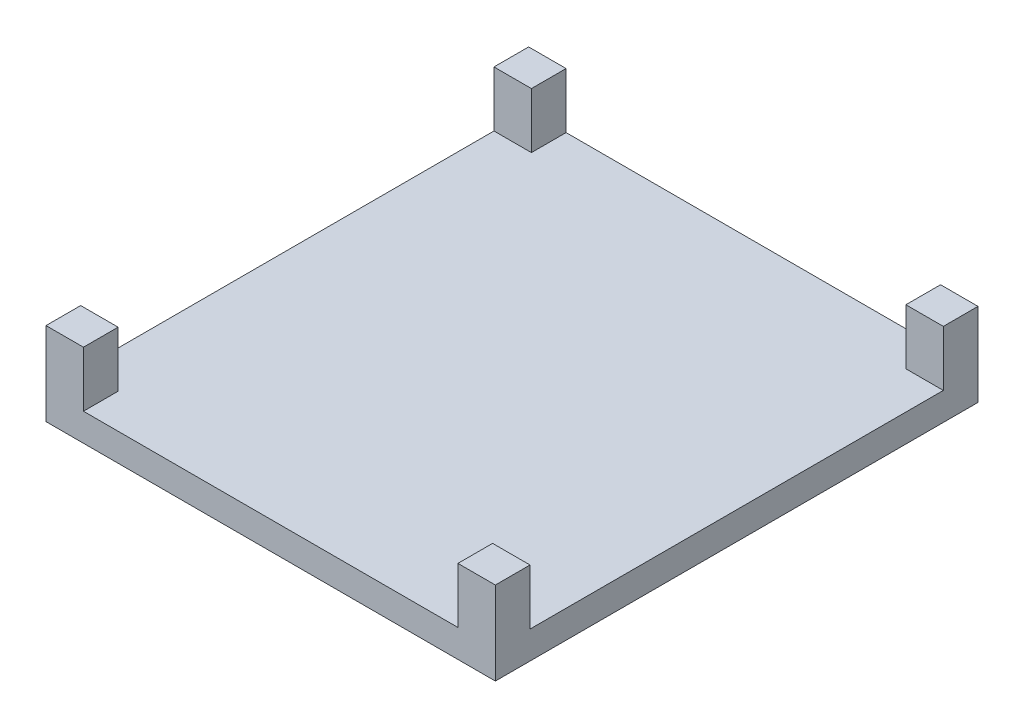
from build123d import *

# Parameters (mm, degrees)
SKETCH2_4_W         = 82.296
SKETCH2_4_H         = 88.392
BOSS_EXTRUDE3_DEPTH = 5.08
SKETCH5_W           = 6.858
SKETCH5_H           = 6.35
BOSS_EXTRUDE4_DEPTH = 10.16


with BuildPart() as part:
    # Sketch2<4> → Boss-Extrude3 (new body)
    with BuildSketch(Plane(origin=(0, 0, 0), x_dir=(1, 0, 0), z_dir=(0, 1, 0))):
        Rectangle(SKETCH2_4_W, SKETCH2_4_H)
    extrude(amount=BOSS_EXTRUDE3_DEPTH)

    # Sketch5 → Boss-Extrude4 (add)
    with BuildSketch(Plane(origin=(0, 5.08, 0), x_dir=(1, 0, 0), z_dir=(0, 1, 0))):
        with Locations((-37.719, -41.021)):
            Rectangle(SKETCH5_W, SKETCH5_H)
        with Locations((-37.719, 41.021)):
            Rectangle(SKETCH5_W, SKETCH5_H)
        with Locations((37.719, -41.021)):
            Rectangle(SKETCH5_W, SKETCH5_H)
        with Locations((37.719, 41.021)):
            Rectangle(SKETCH5_W, SKETCH5_H)
    extrude(amount=BOSS_EXTRUDE4_DEPTH)


solid = part.part
